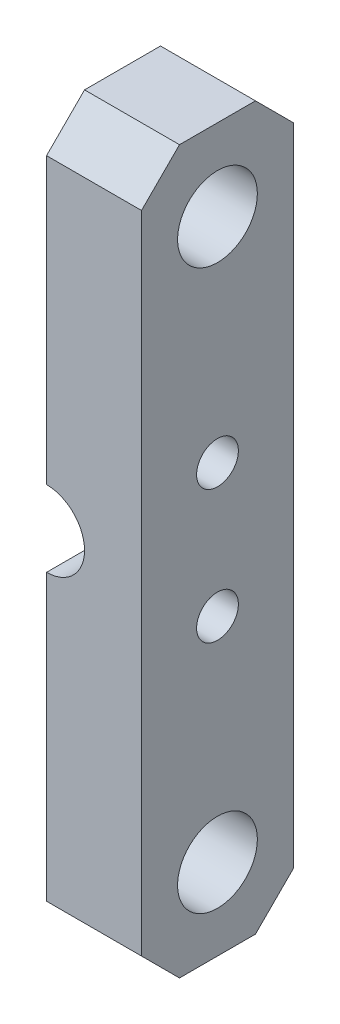
from build123d import *

# Parameters (mm, degrees)
SKETCH1_W           = 16
SKETCH1_H           = 76
BOSS_EXTRUDE1_DEPTH = 10
HOLE1_D             = 4.4
HOLE2_D             = 4.4
HOLE3_D             = 8.4
HOLE4_D             = 8.4
HOLE5_D             = 8
CHAMFER1_SIZE       = 4
CHAMFER2_SIZE       = 4
CHAMFER3_SIZE       = 4
CHAMFER4_SIZE       = 4


with BuildPart() as part:
    # Sketch1 → Boss-Extrude1 (new body)
    with BuildSketch(Plane(origin=(10, 0, 0), x_dir=(0, 0, -1), z_dir=(1, 0, 0))):
        with Locations((10, 0)):
            Rectangle(SKETCH1_W, SKETCH1_H)
    extrude(amount=-BOSS_EXTRUDE1_DEPTH)

    # Hole1 (through all)
    with Locations(Plane(origin=(10, 0, 0), x_dir=(0, 0, -1), z_dir=(1, 0, 0))):
        with Locations((10, -7)):
            Hole(HOLE1_D / 2)

    # Hole2 (through all)
    with Locations(Plane(origin=(10, 0, 0), x_dir=(0, 0, -1), z_dir=(1, 0, 0))):
        with Locations((10, 7)):
            Hole(HOLE2_D / 2)

    # Hole3 (through all)
    with Locations(Plane(origin=(10, 0, 0), x_dir=(0, 0, -1), z_dir=(1, 0, 0))):
        with Locations((10, -29.444863729)):
            Hole(HOLE3_D / 2)

    # Hole4 (through all)
    with Locations(Plane(origin=(10, 0, 0), x_dir=(0, 0, -1), z_dir=(1, 0, 0))):
        with Locations((10, 29.444863729)):
            Hole(HOLE4_D / 2)

    # Hole5 (through all)
    with Locations(Plane.XY.offset(-2)):
        with Locations((0, 0)):
            Hole(HOLE5_D / 2)

    # Chamfer1
    chamfer1_edges = [part.edges().sort_by_distance(p)[0] for p in [
        (5, 38, -2),
    ]]
    chamfer(chamfer1_edges, length=CHAMFER1_SIZE)

    # Chamfer2
    chamfer2_edges = [part.edges().sort_by_distance(p)[0] for p in [
        (5, 38, -18),
    ]]
    chamfer(chamfer2_edges, length=CHAMFER2_SIZE)

    # Chamfer3
    chamfer3_edges = [part.edges().sort_by_distance(p)[0] for p in [
        (5, -38, -18),
    ]]
    chamfer(chamfer3_edges, length=CHAMFER3_SIZE)

    # Chamfer4
    chamfer4_edges = [part.edges().sort_by_distance(p)[0] for p in [
        (5, -38, -2),
    ]]
    chamfer(chamfer4_edges, length=CHAMFER4_SIZE)


solid = part.part
